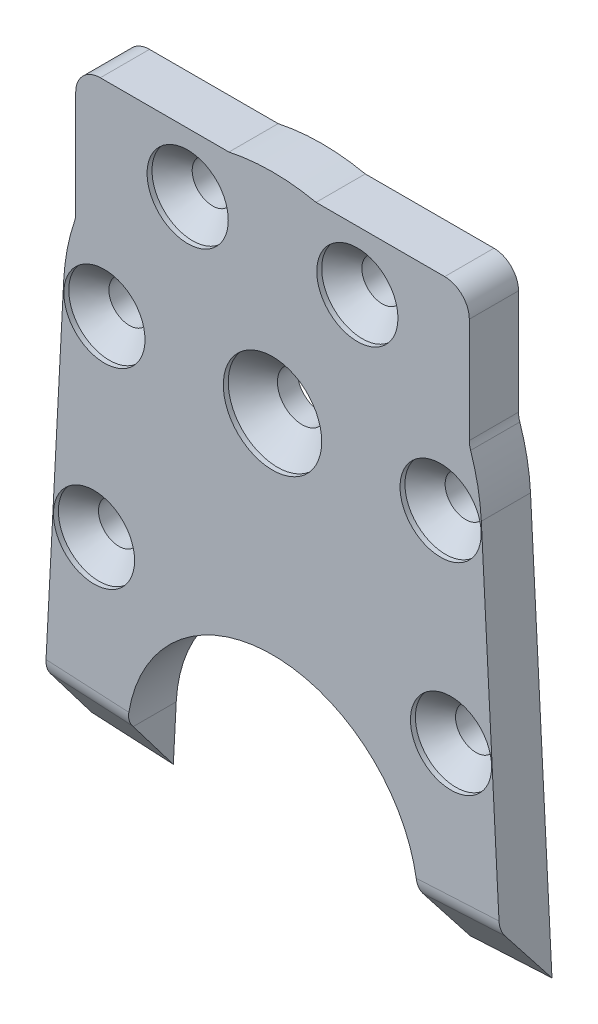
from build123d import *

# Parameters (mm, degrees)
SKETCH1_R                                      = 1.25
SKETCH1_R_2                                    = 1.5
BOSS_EXTRUDE1_DEPTH                            = 3
CSK_FOR_M2_5_FLAT_HEAD_MACHINE_SCREW2_AT_COUNT = 2
CSK_FOR_M2_5_FLAT_HEAD_MACHINE_SCREW2_AT_PITCH = 10.201972061
CSK_FOR_M2_5_FLAT_HEAD_MACHINE_SCREW_2_COUNT   = 2
CSK_FOR_M2_5_FLAT_HEAD_MACHINE_SCREW_2_PITCH   = 17.781163237
CSK_FOR_M2_5_FLAT_HEAD_MACHINE_SCREW_3_COUNT   = 2
CSK_FOR_M2_5_FLAT_HEAD_MACHINE_SCREW_3_PITCH   = 20.5
CSK_FOR_M2_5_FLAT_HEAD_MACHINE_SCREW_4_COUNT   = 2
CSK_FOR_M2_5_FLAT_HEAD_MACHINE_SCREW_4_PITCH   = 12
CSK_FOR_M2_5_FLAT_HEAD_MACHINE_SCREW_5_COUNT   = 2
CSK_FOR_M2_5_FLAT_HEAD_MACHINE_SCREW_5_PITCH   = 24.295707673
CUT_EXTRUDE4_REACH                             = 38.909
CUT_EXTRUDE5_REACH                             = 38.909
FILLET2_R                                      = 1.5


with BuildPart() as part:
    # Sketch1 → Boss-Extrude1 (new body)
    with BuildSketch(Plane.XY):
        with BuildLine():
            ThreePointArc((12.078947368, 4.081853803), (12.019868427, 4.318739766), (12, 4.562071898))
            Line((12, 4.562071898), (12, 10.970231229))
            ThreePointArc((12, 10.970231229), (11.560660172, 12.030891401), (10.5, 12.470231229))
            Line((10.5, 12.470231229), (2.656281818, 12.470231229))
            ThreePointArc((2.656281818, 12.470231229), (0, 12.75), (-2.656281818, 12.470231229))
            Line((-2.656281818, 12.470231229), (-10.5, 12.470231229))
            ThreePointArc((-10.5, 12.470231229), (-11.560660172, 12.030891401), (-12, 10.970231229))
            Line((-12, 10.970231229), (-12, 4.562071898))
            ThreePointArc((-12, 4.562071898), (-12.019868427, 4.318739766), (-12.078947368, 4.081853803))
            ThreePointArc((-12.078947368, 4.081853803), (-12.522664749, 2.396949642), (-12.732526568, 0.667283442))
            Line((-12.732526568, 0.667283442), (-14.040925474, -24.298454927))
            Line((-14.040925474, -24.298454927), (-9.0477778, -24.560134708))
            Line((-9.0477778, -24.560134708), (-8.869966, -21.167283442))
            ThreePointArc((-8.869966, -21.167283442), (0, -12.75), (8.869966, -21.167283442))
            Line((8.869966, -21.167283442), (9.0477778, -24.560134708))
            Line((9.0477778, -24.560134708), (14.040925474, -24.298454927))
            Line((14.040925474, -24.298454927), (12.732526568, 0.667283442))
            ThreePointArc((12.732526568, 0.667283442), (12.522664749, 2.396949642), (12.078947368, 4.081853803))
        make_face()
        with Locations((5.172915418, 8.848923442)):
            Circle(SKETCH1_R, mode=Mode.SUBTRACT)
        with Locations((10.25, 0)):
            Circle(SKETCH1_R, mode=Mode.SUBTRACT)
        with Locations((10.884912472, -11.983191818)):
            Circle(SKETCH1_R, mode=Mode.SUBTRACT)
        Circle(SKETCH1_R_2, mode=Mode.SUBTRACT)
        with Locations((-10.25, 0)):
            Circle(SKETCH1_R, mode=Mode.SUBTRACT)
        with Locations((-5.172915418, 8.848923442)):
            Circle(SKETCH1_R, mode=Mode.SUBTRACT)
        with Locations((-10.884912472, -11.983191818)):
            Circle(SKETCH1_R, mode=Mode.SUBTRACT)
    extrude(amount=BOSS_EXTRUDE1_DEPTH)

    # Sketch3 → CSK for M3 Flat Head Machine Screw1 (revolve, cut)
    with BuildSketch(Plane(origin=(0, 0, 3), x_dir=(0, -1, 0), z_dir=(1, 0, 0))):
        Polygon((0, 0), (0, 5.901290929), (1.5, 5), (1.5, 1.8), (3, 0.3), (3, 0), align=None)
    revolve(axis=Axis((0, 0, 9.35), (0, 0, -1)), mode=Mode.SUBTRACT)

    # Sketch6 → CSK for M2.5 Flat Head Machine Screw2 (revolve, cut)
    with BuildSketch(Plane(origin=(-10.25, 0, 3), x_dir=(0, -1, 0), z_dir=(1, 0, 0))):
        Polygon((0, 0), (0, 5.751075774), (1.25, 5), (1.25, 1.525), (2.475, 0.3), (2.475, 0), align=None)
    csk_for_m2_5_flat_head_machine_screw2 = revolve(axis=Axis((-10.25, 0, 9.35), (0, 0, -1)), mode=Mode.SUBTRACT)

    # CSK for M2.5 Flat Head Machine Screw2 at: CSK for M2.5 Flat Head Machine Screw2 ×2
    with Locations(*[Vector(0.4976571736965763, 0.8673738164530538, 0) * (i * CSK_FOR_M2_5_FLAT_HEAD_MACHINE_SCREW2_AT_PITCH) for i in range(1, CSK_FOR_M2_5_FLAT_HEAD_MACHINE_SCREW2_AT_COUNT)]):
        add(csk_for_m2_5_flat_head_machine_screw2, mode=Mode.SUBTRACT)

    # CSK for M2.5 Flat Head Machine Screw 2: CSK for M2.5 Flat Head Machine Screw2 ×2
    with Locations(*[Vector(0.8673738164530539, 0.497657173696576, 0) * (i * CSK_FOR_M2_5_FLAT_HEAD_MACHINE_SCREW_2_PITCH) for i in range(1, CSK_FOR_M2_5_FLAT_HEAD_MACHINE_SCREW_2_COUNT)]):
        add(csk_for_m2_5_flat_head_machine_screw2, mode=Mode.SUBTRACT)

    # CSK for M2.5 Flat Head Machine Screw 3: CSK for M2.5 Flat Head Machine Screw2 ×2
    with Locations(*[(i * CSK_FOR_M2_5_FLAT_HEAD_MACHINE_SCREW_3_PITCH, 0, 0) for i in range(1, CSK_FOR_M2_5_FLAT_HEAD_MACHINE_SCREW_3_COUNT)]):
        add(csk_for_m2_5_flat_head_machine_screw2, mode=Mode.SUBTRACT)

    # CSK for M2.5 Flat Head Machine Screw 4: CSK for M2.5 Flat Head Machine Screw2 ×2
    with Locations(*[Vector(-0.05290937262723391, -0.9985993181893289, 0) * (i * CSK_FOR_M2_5_FLAT_HEAD_MACHINE_SCREW_4_PITCH) for i in range(1, CSK_FOR_M2_5_FLAT_HEAD_MACHINE_SCREW_4_COUNT)]):
        add(csk_for_m2_5_flat_head_machine_screw2, mode=Mode.SUBTRACT)

    # CSK for M2.5 Flat Head Machine Screw 5: CSK for M2.5 Flat Head Machine Screw2 ×2
    with Locations(*[Vector(0.8699031432206916, -0.4932225881027359, 0) * (i * CSK_FOR_M2_5_FLAT_HEAD_MACHINE_SCREW_5_PITCH) for i in range(1, CSK_FOR_M2_5_FLAT_HEAD_MACHINE_SCREW_5_COUNT)]):
        add(csk_for_m2_5_flat_head_machine_screw2, mode=Mode.SUBTRACT)

    # Sketch10 → Cut-Extrude4 (cut, up to next)
    with BuildSketch(Plane(origin=(12.732526568, 0.667283442, 0), x_dir=(0, 0, -1), z_dir=(0.9986295347545739, 0.052335956242944286, 0)), mode=Mode.PRIVATE) as cut_extrude4_sk1:
        Polygon((-3, -25), (0, -25), (-3, -21.113156261), align=None)
    cut_extrude4_tool1 = extrude(cut_extrude4_sk1.sketch, amount=-CUT_EXTRUDE4_REACH, mode=Mode.PRIVATE) & part.part
    add(cut_extrude4_tool1.solids().sort_by_distance((13.973118, -23.004616, 2))[0], mode=Mode.SUBTRACT)

    # Sketch11 → Cut-Extrude5 (cut, up to next)
    with BuildSketch(Plane(origin=(-12.732526568, 0.667283442, 0), x_dir=(0, 0, 1), z_dir=(-0.9986295347545739, 0.052335956242944716, 0)), mode=Mode.PRIVATE) as cut_extrude5_sk1:
        Polygon((3, -21.113156261), (0, -25), (3, -25), align=None)
    cut_extrude5_tool1 = extrude(cut_extrude5_sk1.sketch, amount=-CUT_EXTRUDE5_REACH, mode=Mode.PRIVATE) & part.part
    add(cut_extrude5_tool1.solids().sort_by_distance((-13.973118, -23.004616, 2))[0], mode=Mode.SUBTRACT)

    # Fillet2
    fillet2_edges = [part.edges().sort_by_distance(p)[0] for p in [
        (11.334194425, -20.548130857, 3),
        (-11.334194425, -20.548130857, 3),
    ]]
    fillet(fillet2_edges, radius=FILLET2_R)


solid = part.part
